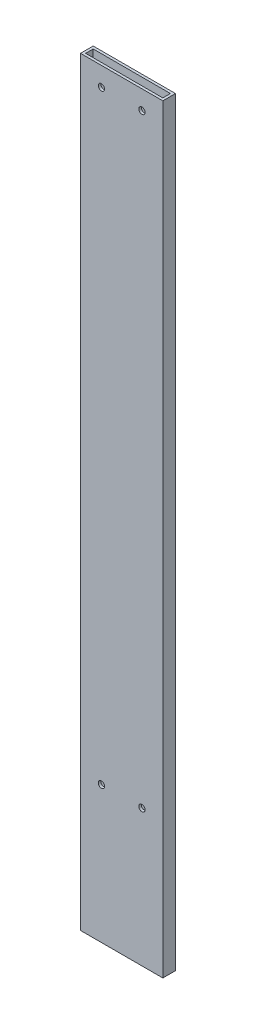
from build123d import *

# Parameters (mm, degrees)
SKETCH1_W           = 65
SKETCH1_H           = 10
SKETCH1_W_2         = 61
SKETCH1_H_2         = 6
BOSS_EXTRUDE1_DEPTH = 600
SKETCH2_R           = 2.5
CUT_EXTRUDE1_DEPTH  = 600


with BuildPart() as part:
    # Sketch1 → Boss-Extrude1 (new body)
    with BuildSketch(Plane(origin=(0, 0, 0), x_dir=(1, 0, 0), z_dir=(0, 1, 0))):
        Rectangle(SKETCH1_W, SKETCH1_H)
        Rectangle(SKETCH1_W_2, SKETCH1_H_2, mode=Mode.SUBTRACT)
    extrude(amount=BOSS_EXTRUDE1_DEPTH)

    # Sketch2 → Cut-Extrude1 (cut)
    with BuildSketch(Plane.XY.offset(5)):
        with Locations((-16, 108)):
            Circle(SKETCH2_R)
        with Locations((16, 108)):
            Circle(SKETCH2_R)
        with Locations((16, 585)):
            Circle(SKETCH2_R)
        with Locations((-16, 585)):
            Circle(SKETCH2_R)
    extrude(amount=-CUT_EXTRUDE1_DEPTH, mode=Mode.SUBTRACT)


solid = part.part
